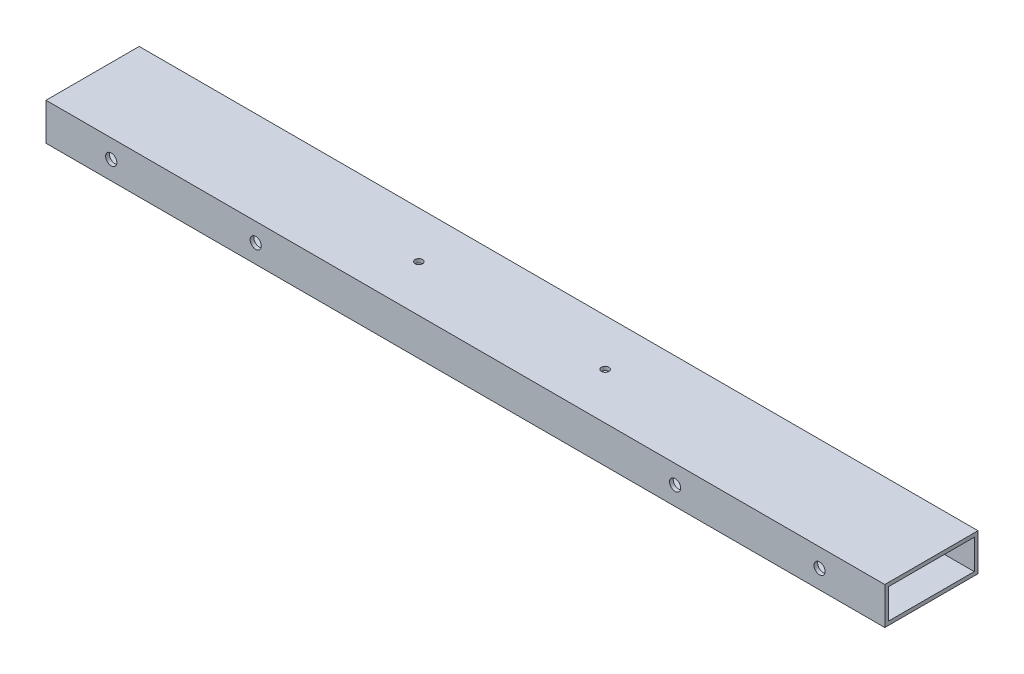
from build123d import *

# Parameters (mm, degrees)
SKETCH_1_W          = 50
SKETCH_1_H          = 20
SKETCH_1_W_2        = 46
SKETCH_1_H_2        = 16
EXTRUDE_1_DEPTH     = 450
CUT_EXTRUDE_1_REACH = 454.88
SKETCH_2_R          = 3
CUT_EXTRUDE_2_REACH = 453.137
SKETCH_3_R          = 2


with BuildPart() as part:
    # Эскиз1 → Бобышка-Вытянуть1 (new body)
    with BuildSketch(Plane(origin=(0, 0, 0), x_dir=(0, 0, -1), z_dir=(1, 0, 0))):
        Rectangle(SKETCH_1_W, SKETCH_1_H)
        Rectangle(SKETCH_1_W_2, SKETCH_1_H_2, mode=Mode.SUBTRACT)
    extrude(amount=EXTRUDE_1_DEPTH)

    # Вырез-Вытянуть1: up to this face of the body (flat: up to its plane)
    cut_extrude_1_end = Plane(part.part.faces().sort_by_distance((225, 0, 25))[0])
    # Эскиз2 → Вырез-Вытянуть1 (cut, up to the picked face)
    with BuildSketch(Plane(origin=(0, 0, -25), x_dir=(-1, 0, 0), z_dir=(0, 0, -1)), mode=Mode.PRIVATE) as cut_extrude_1_sk1:
        with Locations((-415, 0)):
            Circle(SKETCH_2_R)
    cut_extrude_1_tool1 = split(extrude(cut_extrude_1_sk1.sketch, amount=-CUT_EXTRUDE_1_REACH, mode=Mode.PRIVATE), bisect_by=cut_extrude_1_end, keep=Keep.BOTH, mode=Mode.PRIVATE)
    # Эскиз2 → Вырез-Вытянуть1 (cut, up to the picked face)
    with BuildSketch(Plane(origin=(0, 0, -25), x_dir=(-1, 0, 0), z_dir=(0, 0, -1)), mode=Mode.PRIVATE) as cut_extrude_1_sk2:
        with Locations((-337.5, 0)):
            Circle(SKETCH_2_R)
    cut_extrude_1_tool2 = split(extrude(cut_extrude_1_sk2.sketch, amount=-CUT_EXTRUDE_1_REACH, mode=Mode.PRIVATE), bisect_by=cut_extrude_1_end, keep=Keep.BOTH, mode=Mode.PRIVATE)
    # Эскиз2 → Вырез-Вытянуть1 (cut, up to the picked face)
    with BuildSketch(Plane(origin=(0, 0, -25), x_dir=(-1, 0, 0), z_dir=(0, 0, -1)), mode=Mode.PRIVATE) as cut_extrude_1_sk3:
        with Locations((-112.5, 0)):
            Circle(SKETCH_2_R)
    cut_extrude_1_tool3 = split(extrude(cut_extrude_1_sk3.sketch, amount=-CUT_EXTRUDE_1_REACH, mode=Mode.PRIVATE), bisect_by=cut_extrude_1_end, keep=Keep.BOTH, mode=Mode.PRIVATE)
    # Эскиз2 → Вырез-Вытянуть1 (cut, up to the picked face)
    with BuildSketch(Plane(origin=(0, 0, -25), x_dir=(-1, 0, 0), z_dir=(0, 0, -1)), mode=Mode.PRIVATE) as cut_extrude_1_sk4:
        with Locations((-35, 0)):
            Circle(SKETCH_2_R)
    cut_extrude_1_tool4 = split(extrude(cut_extrude_1_sk4.sketch, amount=-CUT_EXTRUDE_1_REACH, mode=Mode.PRIVATE), bisect_by=cut_extrude_1_end, keep=Keep.BOTH, mode=Mode.PRIVATE)
    add(cut_extrude_1_tool1.solids().sort_by(Axis((415, 0, -25), (0, 0, 1)))[0], mode=Mode.SUBTRACT)
    add(cut_extrude_1_tool2.solids().sort_by(Axis((337.5, 0, -25), (0, 0, 1)))[0], mode=Mode.SUBTRACT)
    add(cut_extrude_1_tool3.solids().sort_by(Axis((112.5, 0, -25), (0, 0, 1)))[0], mode=Mode.SUBTRACT)
    add(cut_extrude_1_tool4.solids().sort_by(Axis((35, 0, -25), (0, 0, 1)))[0], mode=Mode.SUBTRACT)

    # Вырез-Вытянуть2: up to this face of the body (flat: up to its plane)
    cut_extrude_2_end = Plane(part.part.faces().sort_by_distance((225, -10, 0))[0])
    # Эскиз3 → Вырез-Вытянуть2 (cut, up to the picked face)
    with BuildSketch(Plane(origin=(0, 10, 0), x_dir=(1, 0, 0), z_dir=(0, 1, 0)), mode=Mode.PRIVATE) as cut_extrude_2_sk1:
        with Locations(Location((175, 0, 0), (0, 0, 270))):
            Circle(SKETCH_3_R)
    cut_extrude_2_tool1 = split(extrude(cut_extrude_2_sk1.sketch, amount=-CUT_EXTRUDE_2_REACH, mode=Mode.PRIVATE), bisect_by=cut_extrude_2_end, keep=Keep.BOTH, mode=Mode.PRIVATE)
    # Эскиз3 → Вырез-Вытянуть2 (cut, up to the picked face)
    with BuildSketch(Plane(origin=(0, 10, 0), x_dir=(1, 0, 0), z_dir=(0, 1, 0)), mode=Mode.PRIVATE) as cut_extrude_2_sk2:
        with Locations(Location((275, 0, 0), (0, 0, 270))):
            Circle(SKETCH_3_R)
    cut_extrude_2_tool2 = split(extrude(cut_extrude_2_sk2.sketch, amount=-CUT_EXTRUDE_2_REACH, mode=Mode.PRIVATE), bisect_by=cut_extrude_2_end, keep=Keep.BOTH, mode=Mode.PRIVATE)
    add(cut_extrude_2_tool1.solids().sort_by(Axis((175, 10, 0), (0, -1, 0)))[0], mode=Mode.SUBTRACT)
    add(cut_extrude_2_tool2.solids().sort_by(Axis((275, 10, 0), (0, -1, 0)))[0], mode=Mode.SUBTRACT)


solid = part.part
